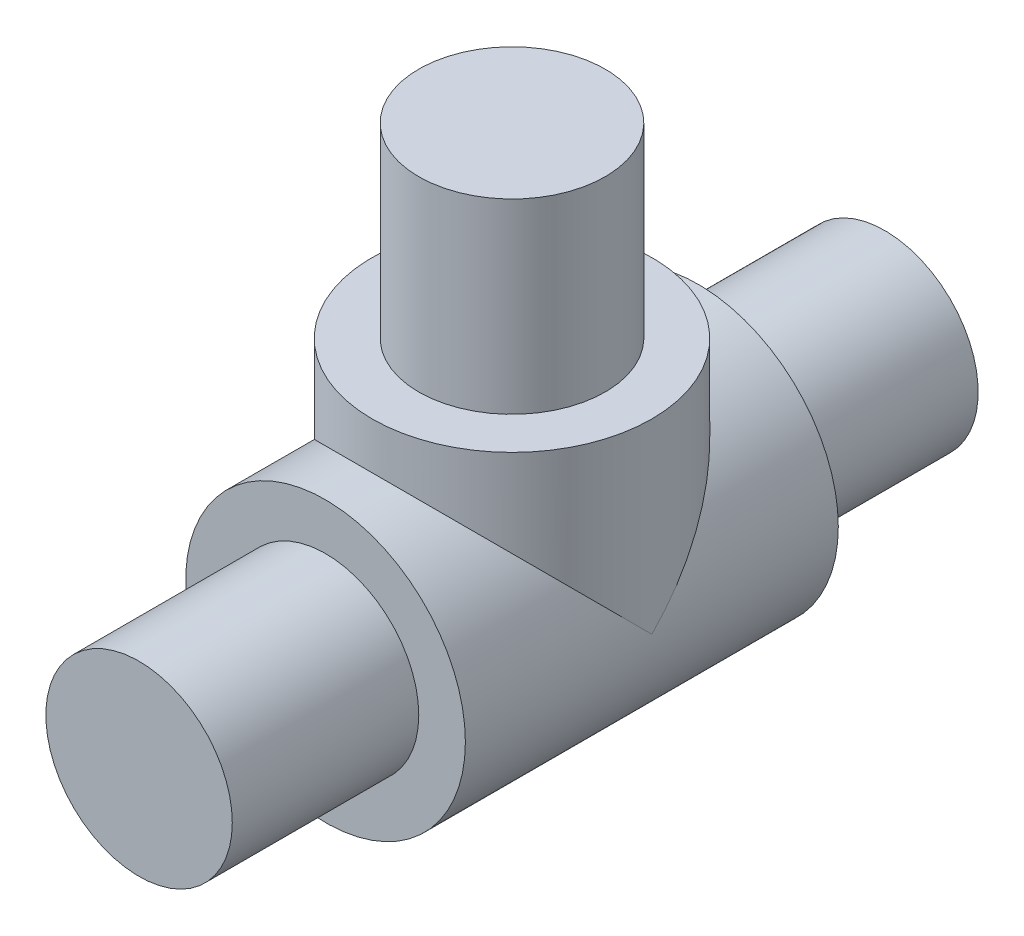
from build123d import *

# Parameters (mm, degrees)
SKETCH2_R           = 3.81
BOSS_EXTRUDE1_DEPTH = 10.16
SKETCH3_R           = 2.54
BOSS_EXTRUDE2_DEPTH = 5.08
BOSS_EXTRUDE3_START = 5.08
SKETCH4_R           = 2.54
BOSS_EXTRUDE3_DEPTH = 5.08
SKETCH5_R           = 3.81
BOSS_EXTRUDE4_DEPTH = 5.08
SKETCH6_R           = 2.54
BOSS_EXTRUDE5_DEPTH = 5.08


with BuildPart() as part:
    # Sketch2 → Boss-Extrude1 (new body)
    with BuildSketch(Plane.XY):
        Circle(SKETCH2_R)
    extrude(amount=BOSS_EXTRUDE1_DEPTH)

    # Sketch3 → Boss-Extrude2 (add)
    with BuildSketch(Plane.XY.offset(10.16)):
        Circle(SKETCH3_R)
    extrude(amount=BOSS_EXTRUDE2_DEPTH)

    # Sketch4 → Boss-Extrude3 (add)
    with BuildSketch(Plane(origin=(0, 0, 0), x_dir=(-1, 0, 0), z_dir=(0, 0, -1)).offset(BOSS_EXTRUDE3_START)):
        with Locations(Location((0, 0, 0), (0, 0, 180))):
            Circle(SKETCH4_R)
    extrude(amount=-BOSS_EXTRUDE3_DEPTH)

    # Sketch5 → Boss-Extrude4 (add)
    with BuildSketch(Plane(origin=(0, 0, 0), x_dir=(1, 0, 0), z_dir=(0, 1, 0))):
        with Locations((0, -5.08)):
            Circle(SKETCH5_R)
    extrude(amount=BOSS_EXTRUDE4_DEPTH)

    # Sketch6 → Boss-Extrude5 (add)
    with BuildSketch(Plane(origin=(0, 5.08, 0), x_dir=(1, 0, 0), z_dir=(0, 1, 0))):
        with Locations(Location((0, -5.08, 0), (0, 0, 270))):
            Circle(SKETCH6_R)
    extrude(amount=BOSS_EXTRUDE5_DEPTH)


solid = part.part
